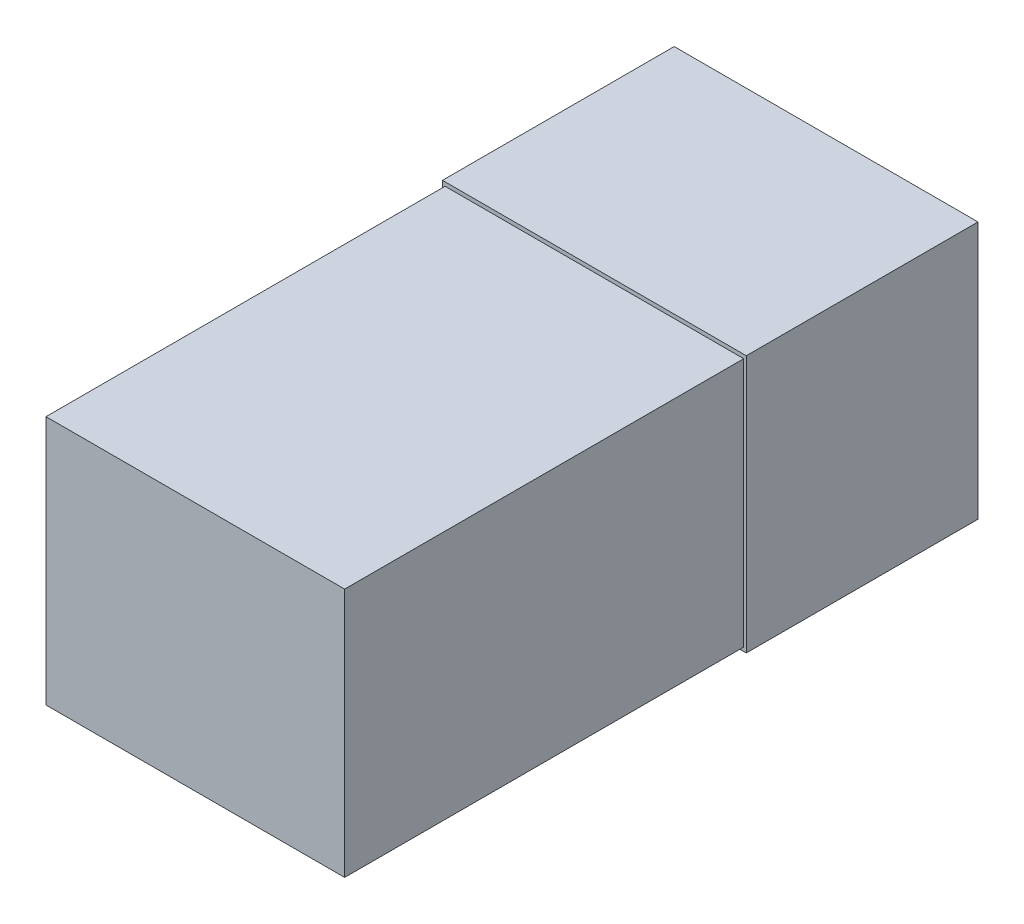
from build123d import *

# Parameters (mm, degrees)
CROQUIS1_W              = 11.6
CROQUIS1_H              = 9.7
SALIENTE_EXTRUIR1_DEPTH = 15.5
CROQUIS2_W              = 11.8
CROQUIS2_H              = 10
SALIENTE_EXTRUIR2_DEPTH = 9


with BuildPart() as part:
    # Croquis1 → Saliente-Extruir1 (new body)
    with BuildSketch(Plane.XY):
        Rectangle(CROQUIS1_W, CROQUIS1_H)
    extrude(amount=SALIENTE_EXTRUIR1_DEPTH)

    # Croquis2 → Saliente-Extruir2 (add)
    with BuildSketch(Plane(origin=(0, 0, 0), x_dir=(-1, 0, 0), z_dir=(0, 0, -1))):
        Rectangle(CROQUIS2_W, CROQUIS2_H)
    extrude(amount=SALIENTE_EXTRUIR2_DEPTH)


solid = part.part
